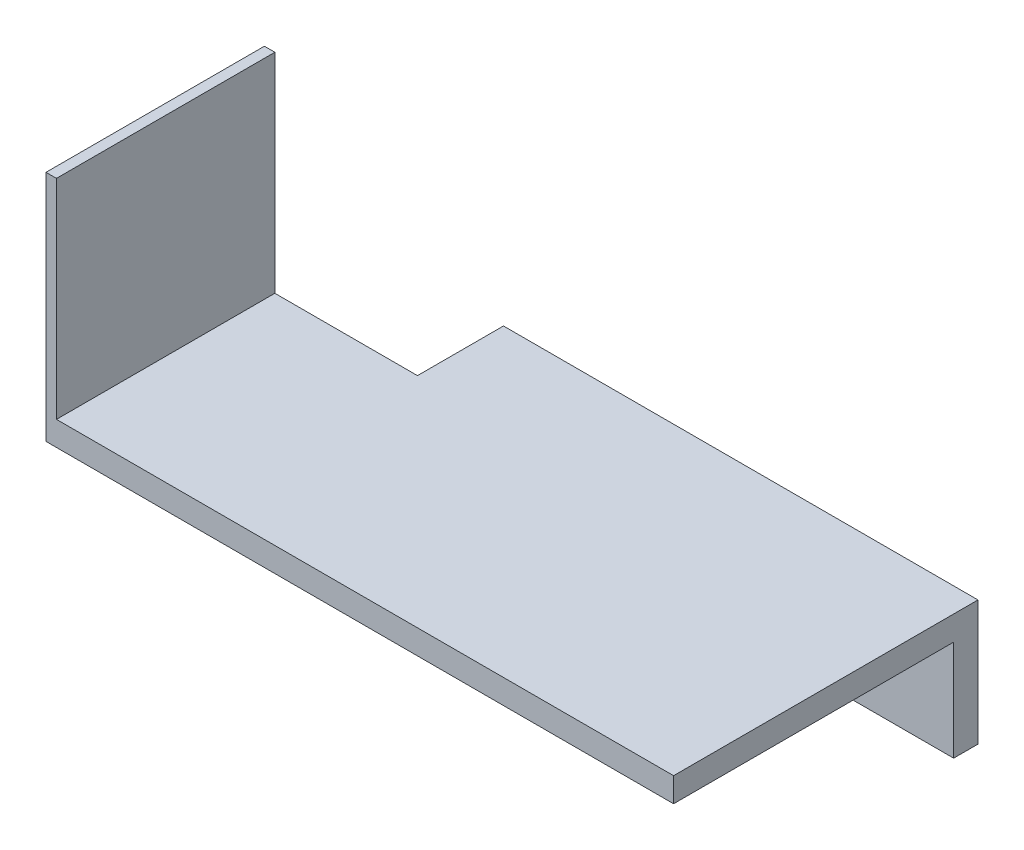
from build123d import *

# Parameters (mm, degrees)
SKETCH_1_W          = 68.2
SKETCH_1_H          = 17.95
EXTRUDE_1_DEPTH     = 3.5
SKETCH_21_W         = 68.2
SKETCH_21_H         = 3.5
EXTRUDE_4_DEPTH     = 28.25
SKETCH_24_R         = 2.85
CUT_EXTRUDE_2_DEPTH = 28.25
SKETCH_30_W         = 68.2
SKETCH_30_H         = 3.5
EXTRUDE_6_DEPTH     = 12
SKETCH_31_W         = 31.388626345
SKETCH_31_H         = 3.5
EXTRUDE_7_DEPTH     = 22
SKETCH_32_W         = 1.503469792
SKETCH_32_H         = 31.388626345
EXTRUDE_8_DEPTH     = 30


with BuildPart() as part:
    # 草圖1 → 1 (new body)
    with BuildSketch(Plane.XY):
        Rectangle(SKETCH_1_W, SKETCH_1_H)
    extrude(amount=EXTRUDE_1_DEPTH)

    # 草圖21 → 填料-伸長4 (add)
    with BuildSketch(Plane.XY.offset(3.5)):
        with Locations((0, 7.225)):
            Rectangle(SKETCH_21_W, SKETCH_21_H)
    extrude(amount=EXTRUDE_4_DEPTH)

    # 草圖24 → 除料-伸長2 (cut)
    with BuildSketch(Plane(origin=(0, 0, 0), x_dir=(-1, 0, 0), z_dir=(0, 0, -1))):
        with Locations((0, -3.070533486)):
            Circle(SKETCH_24_R)
    extrude(amount=-CUT_EXTRUDE_2_DEPTH, mode=Mode.SUBTRACT)

    # 草圖30 → 填料-伸長6 (add)
    with BuildSketch(Plane.XY.offset(31.75)):
        with Locations((0, 7.225)):
            Rectangle(SKETCH_30_W, SKETCH_30_H)
    extrude(amount=EXTRUDE_6_DEPTH)

    # 草圖31 → 填料-伸長7 (add)
    with BuildSketch(Plane.ZY.offset(34.1)):
        with Locations((28.055686828, 7.225)):
            Rectangle(SKETCH_31_W, SKETCH_31_H)
    extrude(amount=EXTRUDE_7_DEPTH)

    # 草圖32 → 填料-伸長8 (add)
    with BuildSketch(Plane(origin=(0, 8.975, 0), x_dir=(1, 0, 0), z_dir=(0, 1, 0))):
        with Locations((-55.348265104, -28.055686828)):
            Rectangle(SKETCH_32_W, SKETCH_32_H)
    extrude(amount=EXTRUDE_8_DEPTH)


solid = part.part
